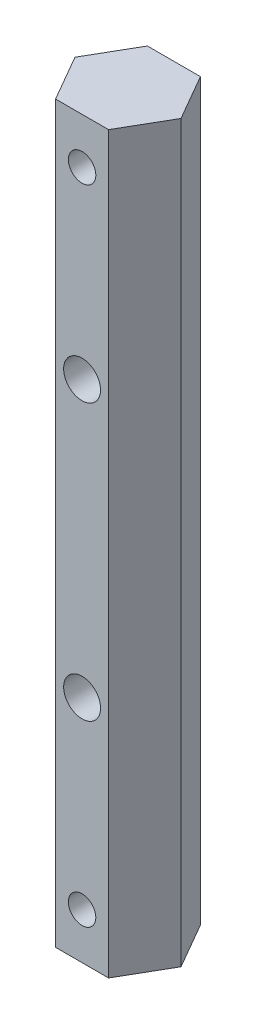
from build123d import *

# Parameters (mm, degrees)
BOSS_EXTRUDE1_DEPTH        = 101.6
TAP_DRILL_FOR_10_24_TAP1_D = 3.7973
SKETCH6_R                  = 2.5527
CUT_EXTRUDE1_DEPTH         = 103.652877862


with BuildPart() as part:
    # Sketch1 → Boss-Extrude1 (new body)
    with BuildSketch(Plane(origin=(0, 0, 0), x_dir=(1, 0, 0), z_dir=(0, 1, 0))):
        Polygon((7.332348419, 0), (3.666174209, 6.35), (-3.666174209, 6.35), (-7.332348419, 0), (-3.666174209, -6.35), (3.666174209, -6.35), align=None)
    extrude(amount=BOSS_EXTRUDE1_DEPTH)

    # Tap Drill for #10-24 Tap1 (through all)
    with Locations(Plane.XY.offset(6.35)):
        with Locations((0, 95.25), (0, 6.35)):
            Hole(TAP_DRILL_FOR_10_24_TAP1_D / 2)

    # Sketch6 → Cut-Extrude1 (cut, through all)
    with BuildSketch(Plane.XY.offset(6.35)):
        with Locations((0, 31.75)):
            Circle(SKETCH6_R)
        with Locations((0, 69.85)):
            Circle(SKETCH6_R)
    extrude(amount=-CUT_EXTRUDE1_DEPTH, mode=Mode.SUBTRACT)


solid = part.part
